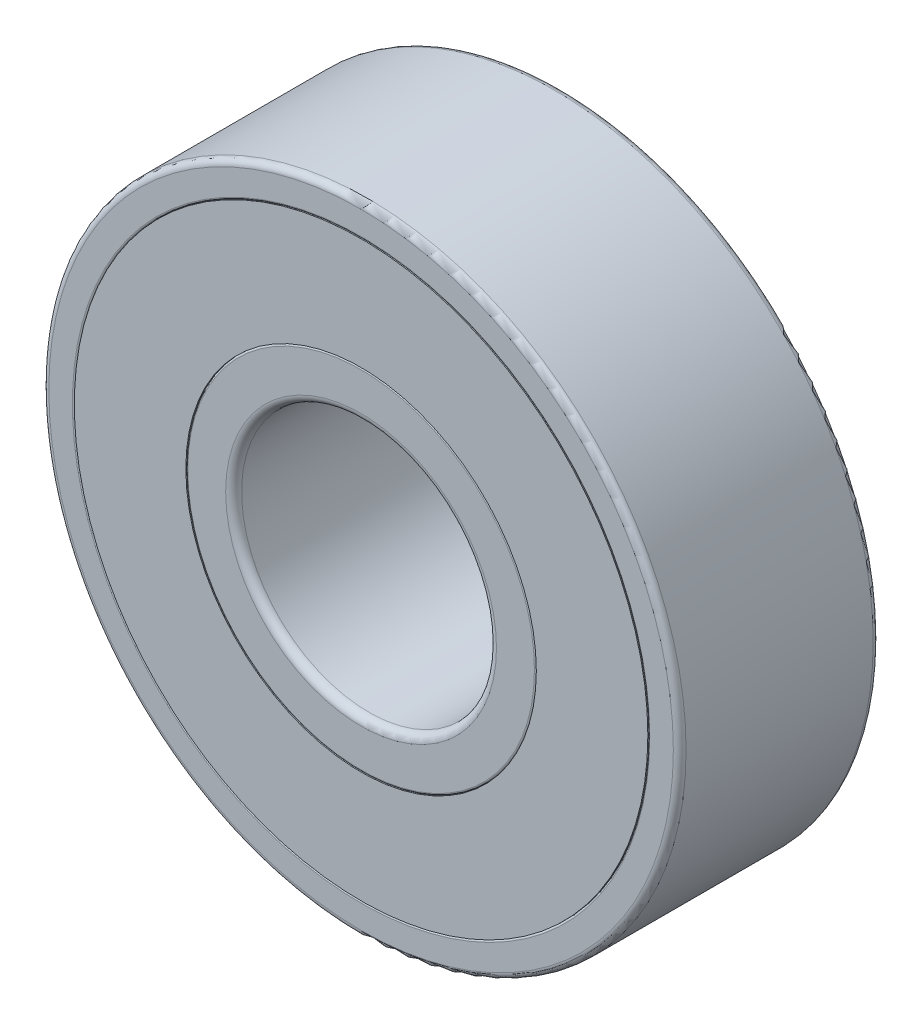
from build123d import *

# Parameters (mm, degrees)
SKETCH3_W           = 4.9784
SKETCH3_H           = 0.79375
SKETCH3_H_2         = 1.190625
SKETCH4_R           = 1.666875
CIRPATTERN1_COUNT   = 7
FILLET1_R           = 0.15875
FILLET2_R           = 0.1984375
FILLET3_R           = 0.047625
FILLET4_R           = 0.047625
SKETCH6_R           = 7.14375
SKETCH6_R_2         = 4.365625
BOSS_EXTRUDE2_DEPTH = 2.4892


with BuildPart() as part:
    # Sketch3 → Revolve1 (revolve)
    with BuildSketch(Plane(origin=(0, 0, 0), x_dir=(0, 0, -1), z_dir=(1, 0, 0)), mode=Mode.PRIVATE) as revolve1_sk:
        with Locations((0, -7.540625)):
            Rectangle(SKETCH3_W, SKETCH3_H)
        with Locations((0, -3.7703125)):
            Rectangle(SKETCH3_W, SKETCH3_H_2)
    revolve(revolve1_sk.sketch.rotate(Axis((0, 0, 2.4892), (0, 0, -1)), 270), axis=Axis((0, 0, 2.4892), (0, 0, -1)))

    # Sketch4 → Cut-Revolve1 (revolve, cut)
    with BuildSketch(Plane(origin=(0, 0, 0), x_dir=(0, 0, -1), z_dir=(1, 0, 0)), mode=Mode.PRIVATE) as cut_revolve1_sk:
        with Locations((0, -5.7546875)):
            Circle(SKETCH4_R)
    revolve(cut_revolve1_sk.sketch.rotate(Axis((0, 0, 2.4892), (0, 0, -1)), 270), axis=Axis((0, 0, 2.4892), (0, 0, -1)), mode=Mode.SUBTRACT)

    # Fillet1
    fillet1_edges = [part.edges().sort_by_distance(p)[0] for p in [
        (-7.9375, 0, -2.4892),
        (-7.9375, 0, 2.4892),
    ]]
    fillet(fillet1_edges, radius=FILLET1_R)

    # Fillet2
    fillet2_edges = [part.edges().sort_by_distance(p)[0] for p in [
        (-3.175, 0, -2.4892),
        (-3.175, 0, 2.4892),
    ]]
    fillet(fillet2_edges, radius=FILLET2_R)

    # Fillet3
    fillet3_edges = [part.edges().sort_by_distance(p)[0] for p in [
        (-7.14375, 0, 2.4892),
        (-7.14375, 0, -2.4892),
    ]]
    fillet(fillet3_edges, radius=FILLET3_R)

    # Fillet4
    fillet4_edges = [part.edges().sort_by_distance(p)[0] for p in [
        (-4.365625, 0, 2.4892),
        (-4.365625, 0, -2.4892),
    ]]
    fillet(fillet4_edges, radius=FILLET4_R)


with BuildPart() as body_2:
    # Sketch5 → Revolve2 (revolve)
    with BuildSketch(Plane(origin=(0, 0, 0), x_dir=(0, 0, -1), z_dir=(1, 0, 0))):
        with BuildLine():
            Line((0, -4.0878125), (0, -7.4215625))
            ThreePointArc((0, -7.4215625), (1.666875, -5.7546875), (0, -4.0878125))
        make_face()
    revolve(axis=Axis((0, -4.0878125, 0), (0, -1, 0)))


with BuildPart() as cirpattern1_1:
    # CirPattern1: pattern copy
    add(body_2.part.rotate(Axis((0, 0, 0), (0, 0, 1)), 1 * 360 / CIRPATTERN1_COUNT))


with BuildPart() as cirpattern1_2:
    # CirPattern1: pattern copy
    add(body_2.part.rotate(Axis((0, 0, 0), (0, 0, 1)), 2 * 360 / CIRPATTERN1_COUNT))


with BuildPart() as cirpattern1_3:
    # CirPattern1: pattern copy
    add(body_2.part.rotate(Axis((0, 0, 0), (0, 0, 1)), 3 * 360 / CIRPATTERN1_COUNT))


with BuildPart() as cirpattern1_4:
    # CirPattern1: pattern copy
    add(body_2.part.rotate(Axis((0, 0, 0), (0, 0, 1)), 4 * 360 / CIRPATTERN1_COUNT))


with BuildPart() as cirpattern1_5:
    # CirPattern1: pattern copy
    add(body_2.part.rotate(Axis((0, 0, 0), (0, 0, 1)), 5 * 360 / CIRPATTERN1_COUNT))


with BuildPart() as cirpattern1_6:
    # CirPattern1: pattern copy
    add(body_2.part.rotate(Axis((0, 0, 0), (0, 0, 1)), 6 * 360 / CIRPATTERN1_COUNT))


with BuildPart() as body_9:
    # Sketch6 → Boss-Extrude2 (new, symmetric)
    with BuildSketch(Plane.XY):
        Circle(SKETCH6_R)
        Circle(SKETCH6_R_2, mode=Mode.SUBTRACT)
    extrude(amount=BOSS_EXTRUDE2_DEPTH, both=True)


solid = Compound([part.part, body_2.part, cirpattern1_1.part, cirpattern1_2.part, cirpattern1_3.part, cirpattern1_4.part, cirpattern1_5.part, cirpattern1_6.part, body_9.part])
